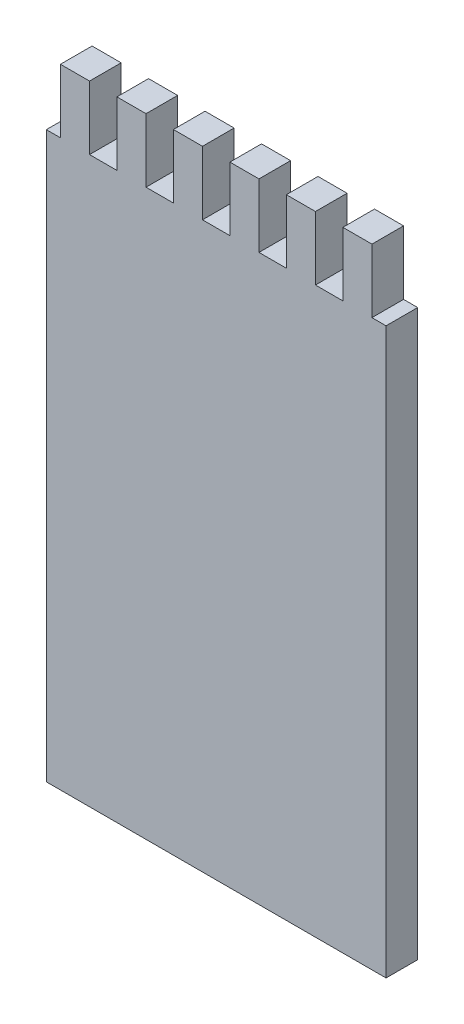
from build123d import *

# Parameters (mm, degrees)
ESTRUSIONE_ESTRUSIONE1_DEPTH = 5.6


with BuildPart() as part:
    # Schizzo1 → Estrusione-Estrusione1 (new body)
    with BuildSketch(Plane.XY):
        Polygon((-17.575, 55.875), (-12.425, 55.875), (-12.425, 44.6), (-7.575, 44.6), (-7.575, 55.875), (-2.425, 55.875), (-2.425, 44.6), (2.425, 44.6), (2.425, 55.875), (7.575, 55.875), (7.575, 44.6), (12.425, 44.6), (12.425, 55.875), (17.575, 55.875), (17.575, 44.6), (22.425, 44.6), (22.425, 55.875), (27.575, 55.875), (27.575, 44.6), (30.075, 44.6), (30.075, -55.4), (27.575, -55.4), (-27.575, -55.4), (-30.075, -55.4), (-30.075, 44.6), (-27.575, 44.6), (-27.575, 55.875), (-22.425, 55.875), (-22.425, 44.6), (-17.575, 44.6), align=None)
    extrude(amount=ESTRUSIONE_ESTRUSIONE1_DEPTH)


solid = part.part
